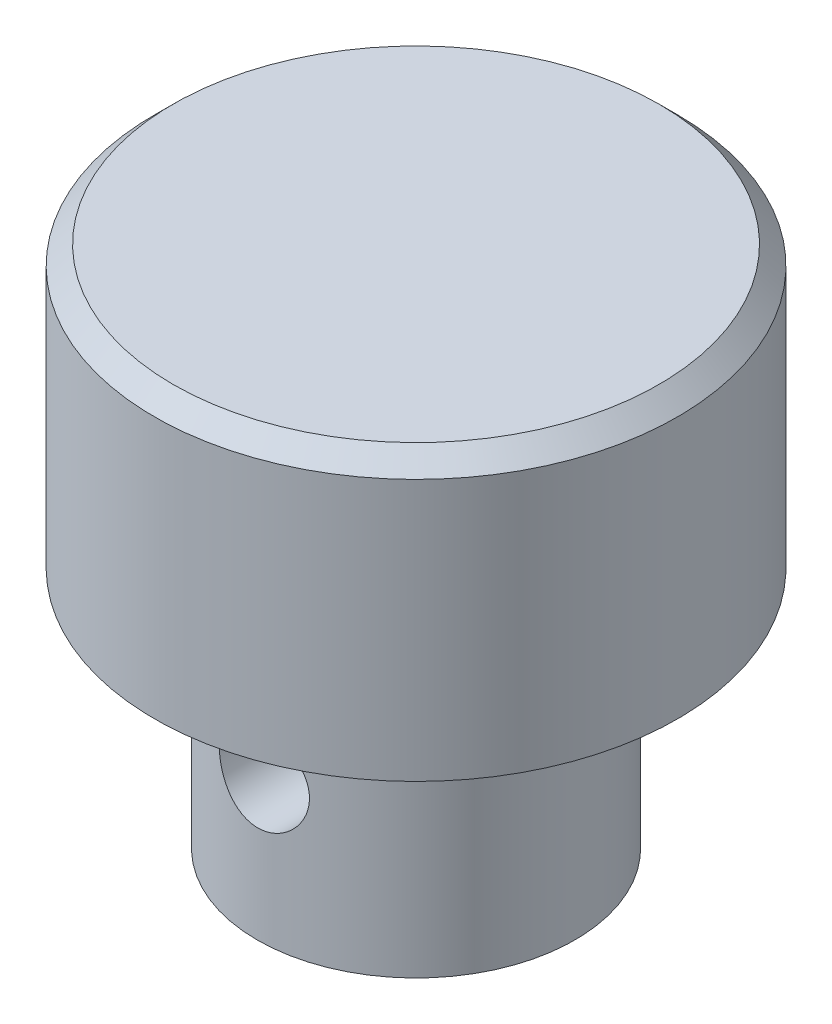
from build123d import *

# Parameters (mm, degrees)
SMUSSO1_SIZE              = 0.5
SCHIZZO2_R                = 1.5
TAGLIO_ESTRUSIONE1_DEPTH  = 10
FORO_PER_VITE_M2_2_REACH  = 18.726
FORO_PER_VITE_M2_2_BORE_R = 1.2


with BuildPart() as part:
    # Schizzo1 → Rivoluzione1 (revolve)
    with BuildSketch(Plane.XY, mode=Mode.PRIVATE) as rivoluzione1_sk:
        Polygon((-7, 14), (-7, 6.5), (-4.25, 6.5), (-4.25, 0), (0, 0), (0, 14), align=None)
    revolve(rivoluzione1_sk.sketch.rotate(Axis((0, 0, 0), (0, 1, 0)), 270), axis=Axis((0, 0, 0), (0, 1, 0)))

    # Smusso1
    smusso1_edges = [part.edges().sort_by_distance(p)[0] for p in [
        (0, 14, 7),
    ]]
    chamfer(smusso1_edges, length=SMUSSO1_SIZE)

    # Schizzo2 → Taglio-Estrusione1 (cut)
    with BuildSketch(Plane(origin=(0, 0, 0), x_dir=(-1, 0, 0), z_dir=(0, -1, 0))):
        with Locations(Location((0, 0, 0), (0, 0, 90))):
            Circle(SCHIZZO2_R)
    extrude(amount=-TAGLIO_ESTRUSIONE1_DEPTH, mode=Mode.SUBTRACT)

    # Foro per Vite M2-2 bore (on position points) → Foro per Vite M2-2 (cut, up to next)
    with BuildSketch(Plane(origin=(0.020038274, 3.80568373, 4.249952761), x_dir=(0.999988884854, 0, -0.004714888012), z_dir=(0.004714888012, 0, 0.999988884854)), mode=Mode.PRIVATE) as foro_per_vite_m2_2_sk1:
        Circle(FORO_PER_VITE_M2_2_BORE_R)
    foro_per_vite_m2_2_tool1 = extrude(foro_per_vite_m2_2_sk1.sketch, amount=-FORO_PER_VITE_M2_2_REACH, mode=Mode.PRIVATE) & part.part
    add(foro_per_vite_m2_2_tool1.solids().sort_by_distance((0.020038, 3.805684, 4.249953))[0], mode=Mode.SUBTRACT)


solid = part.part
